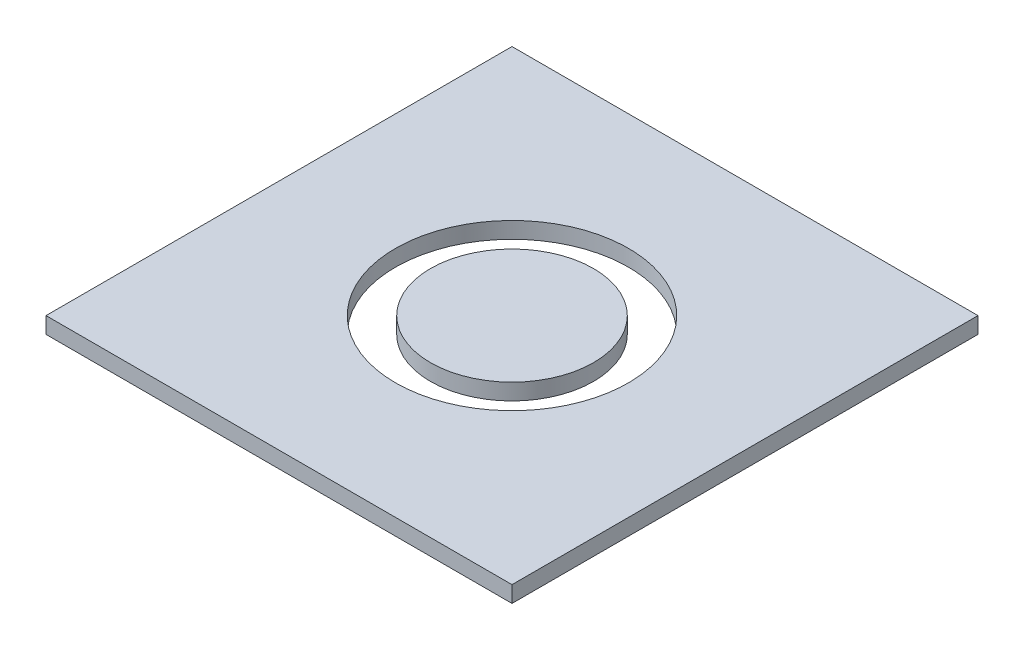
from build123d import *

# Parameters (mm, degrees)
SKETCH3_W           = 20
SKETCH3_H           = 20
BOSS_EXTRUDE3_DEPTH = 0.7
SKETCH5_R           = 5
CUT_EXTRUDE21_DEPTH = 0.7
SKETCH6_R           = 3.5
BOSS_EXTRUDE4_DEPTH = 0.7


with BuildPart() as part:
    # Sketch3 → Boss-Extrude3 (new body)
    with BuildSketch(Plane(origin=(0, 0, 0), x_dir=(1, 0, 0), z_dir=(0, 1, 0))):
        Rectangle(SKETCH3_W, SKETCH3_H)
    extrude(amount=BOSS_EXTRUDE3_DEPTH)

    # Sketch5 → Cut-Extrude21 (cut)
    with BuildSketch(Plane(origin=(0, 0.7, 0), x_dir=(1, 0, 0), z_dir=(0, 1, 0))):
        with Locations(Location((0, 0, 0), (0, 0, 270))):
            Circle(SKETCH5_R)
    extrude(amount=-CUT_EXTRUDE21_DEPTH, mode=Mode.SUBTRACT)


with BuildPart() as body_2:
    # Sketch6 → Boss-Extrude4 (new body)
    with BuildSketch(Plane(origin=(0, 0, 0), x_dir=(1, 0, 0), z_dir=(0, 1, 0))):
        with Locations(Location((0, 0, 0), (0, 0, 270))):
            Circle(SKETCH6_R)
    extrude(amount=BOSS_EXTRUDE4_DEPTH)


solid = Compound([part.part, body_2.part])
